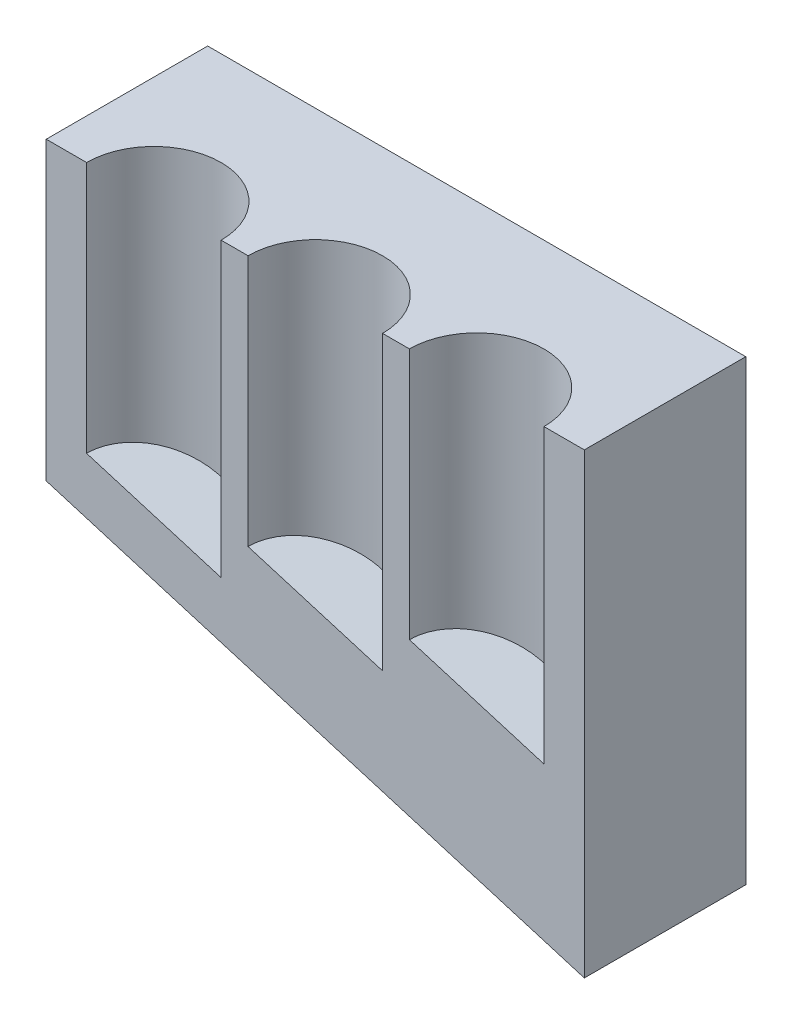
from build123d import *

# Parameters (mm, degrees)
EXTRUDE1_DEPTH  = 30
EXTRUDE2_REACH  = 136.629
SKETCH2_R       = 12.5
LPATTERN1_COUNT = 3
LPATTERN1_PITCH = 30


with BuildPart() as part:
    # Sketch1 → Extrude1 (new body)
    with BuildSketch(Plane.XY):
        Polygon((0, 0), (100, -30), (100, 55), (0, 55), align=None)
    extrude(amount=EXTRUDE1_DEPTH)

    # Extrude2: up to this plane
    extrude2_end = Plane(origin=(2.873478856, 9.578262852, 30), z_dir=(0.2873478855663455, 0.9578262852211514, 0))
    # Sketch2 → Extrude2 (cut, up to the surface)
    with BuildSketch(Plane(origin=(0, 55, 0), x_dir=(1, 0, 0), z_dir=(0, 1, 0)), mode=Mode.PRIVATE) as extrude2_sk1:
        with Locations((20, -30)):
            Circle(SKETCH2_R)
    extrude2_tool1 = split(extrude(extrude2_sk1.sketch, amount=-EXTRUDE2_REACH, mode=Mode.PRIVATE), bisect_by=extrude2_end, keep=Keep.BOTH, mode=Mode.PRIVATE)
    extrude2 = extrude2_tool1.solids().sort_by_distance((20, 55, 30))[0]
    add(extrude2, mode=Mode.SUBTRACT)

    # LPattern1: Extrude2 ×3
    with Locations(*[(i * LPATTERN1_PITCH, 0, 0) for i in range(1, LPATTERN1_COUNT)]):
        add(extrude2, mode=Mode.SUBTRACT)


solid = part.part
